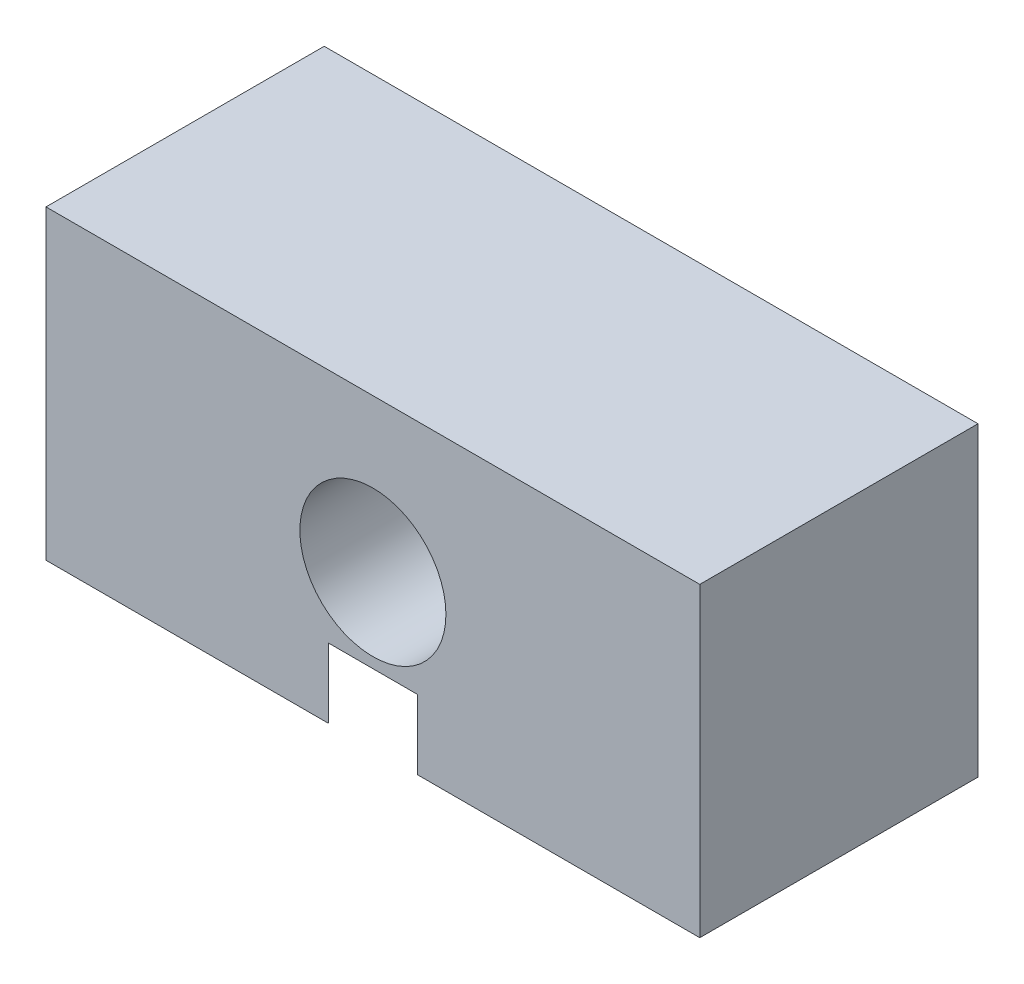
from build123d import *

# Parameters (mm, degrees)
SKETCH1_W           = 47
SKETCH1_H           = 22
SKETCH1_R           = 5.25
BOSS_EXTRUDE1_DEPTH = 20
SKETCH2_R           = 10.5
SKETCH2_W           = 5.562030484
SKETCH2_H           = 6.723730134
CUT_EXTRUDE1_DEPTH  = 5


with BuildPart() as part:
    # Sketch1 → Boss-Extrude1 (new body)
    with BuildSketch(Plane.XY):
        Rectangle(SKETCH1_W, SKETCH1_H)
        Circle(SKETCH1_R, mode=Mode.SUBTRACT)
    extrude(amount=BOSS_EXTRUDE1_DEPTH)

    # Sketch2 → Cut-Extrude1 (cut)
    with BuildSketch(Plane.XZ.offset(11)):
        with BuildLine():
            ThreePointArc((3.201562119, 0), (7.43030884, 2.581070796), (10.004895252, 6.813768529))
            Line((10.004895252, 6.813768529), (10.004895252, 13.186231471))
            ThreePointArc((10.004895252, 13.186231471), (7.43030884, 17.418929204), (3.201562119, 20))
            Line((3.201562119, 20), (-3.201562119, 20))
            ThreePointArc((-3.201562119, 20), (-10.5, 10), (-3.201562119, 0))
            Line((-3.201562119, 0), (3.201562119, 0))
        make_face()
        with Locations((0, 10)):
            Circle(SKETCH2_R)
        with Locations((12.785910494, 10.175633596)):
            Rectangle(SKETCH2_W, SKETCH2_H)
        with BuildLine():
            Line((10.004895252, 13.186231471), (10.004895252, 6.813768529))
            ThreePointArc((10.004895252, 6.813768529), (10.375485534, 8.387765549), (10.5, 10))
            ThreePointArc((10.5, 10), (10.375485534, 11.612234451), (10.004895252, 13.186231471))
        make_face()
    extrude(amount=-CUT_EXTRUDE1_DEPTH, mode=Mode.SUBTRACT)


solid = part.part
